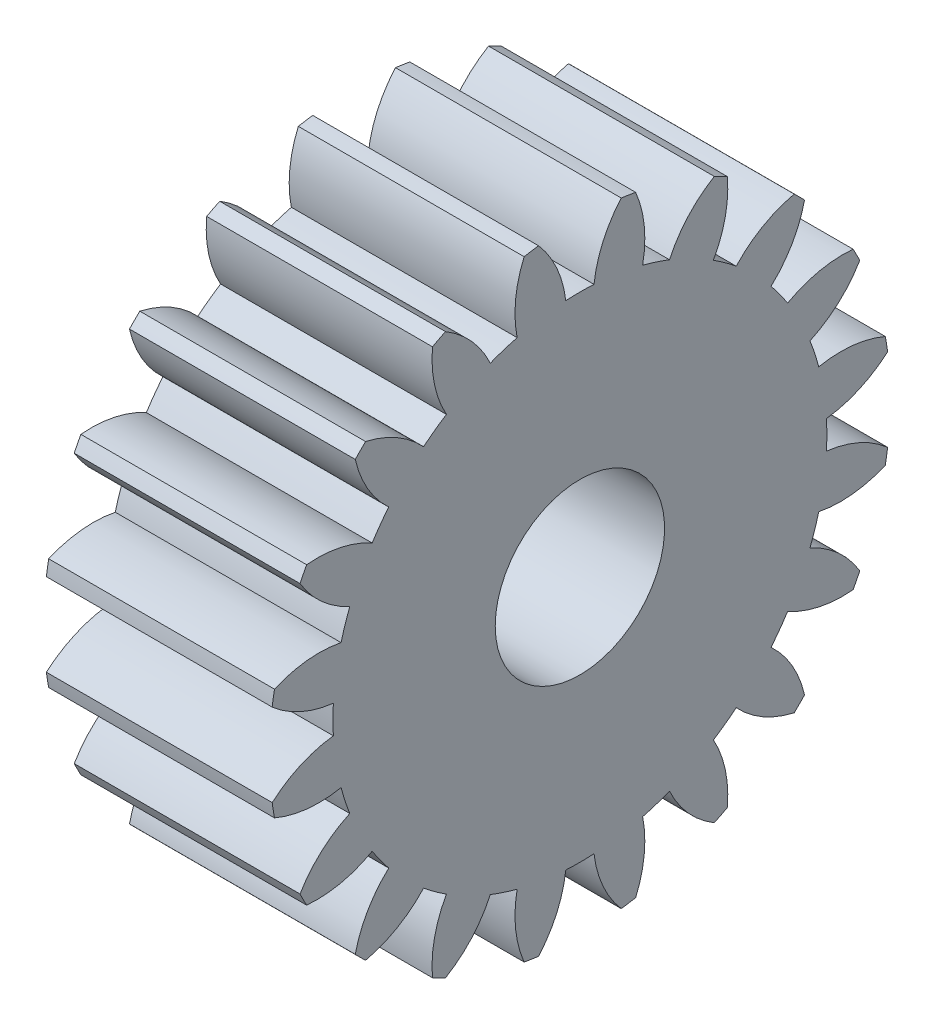
from build123d import *

# Parameters (mm, degrees)
BASPROSKE_W             = 10
BASPROSKE_H             = 11
TOOTHCUT_DEPTH          = 19.493242009
TEETHCUTS_COUNT         = 20
TEETHCUTS_ANGLE         = 342
BORSKE_R                = 3
BORE_DEPTH              = 50.0000508
CUT_EXTRUDE1_DEPTH      = 19.376827944
CUT_EXTRUDE1_DEPTH_BACK = 19.376827944
SKETCH1_W               = 4
SKETCH1_H               = 25


with BuildPart() as part:
    # BasProSke → Base-Revolve (revolve)
    with BuildSketch(Plane(origin=(0, 0, 0), x_dir=(1, 0, 0), z_dir=(0, 1, 0)), mode=Mode.PRIVATE) as base_revolve_sk:
        with Locations((5, 5.5)):
            Rectangle(BASPROSKE_W, BASPROSKE_H)
    revolve(base_revolve_sk.sketch.rotate(Axis((-10, 0, 0), (1, 0, 0)), 180), axis=Axis((-10, 0, 0), (1, 0, 0)))

    # TooCutSke → ToothCut (cut, through all)
    with BuildSketch(Plane(origin=(0, 0, 0), x_dir=(0, 0, -1), z_dir=(1, 0, 0))):
        with BuildLine():
            ThreePointArc((0.499924007, 8.734705318), (0, 8.749), (-0.499924007, 8.734705318))
            ThreePointArc((-0.499924007, 8.734705318), (-0.824302243, 9.905497836), (-1.485192705, 10.924909509))
            ThreePointArc((-1.485192705, 10.924909509), (0, 11.0254), (1.485192705, 10.924909509))
            ThreePointArc((1.485192705, 10.924909509), (0.824302243, 9.905497836), (0.499924007, 8.734705318))
        make_face()
    toothcut = extrude(amount=TOOTHCUT_DEPTH, mode=Mode.SUBTRACT)

    # TeethCuts: ToothCut ×20 about axis
    teethcuts_axis = Axis((-10, 0, 0), (1, 0, 0))
    for i in range(1, TEETHCUTS_COUNT):
        add(toothcut.rotate(teethcuts_axis, i * TEETHCUTS_ANGLE / (TEETHCUTS_COUNT - 1)), mode=Mode.SUBTRACT)

    # BorSke → Bore (cut, symmetric)
    with BuildSketch(Plane(origin=(0, 0, 0), x_dir=(0, 0, -1), z_dir=(1, 0, 0))):
        with Locations(Location((0, 0, 0), (0, 0, 180))):
            Circle(BORSKE_R)
    extrude(amount=BORE_DEPTH, both=True, mode=Mode.SUBTRACT)

    # Sketch1 → Cut-Extrude1 (cut, two sides: drawn at the far end of the back side and taken through both)
    with BuildSketch(Plane(origin=(0, 0, 0), x_dir=(1, 0, 0), z_dir=(0, 1, 0)).offset(-CUT_EXTRUDE1_DEPTH_BACK)):
        with Locations((10, 0)):
            Rectangle(SKETCH1_W, SKETCH1_H)
    extrude(amount=CUT_EXTRUDE1_DEPTH + CUT_EXTRUDE1_DEPTH_BACK, mode=Mode.SUBTRACT)


solid = part.part
